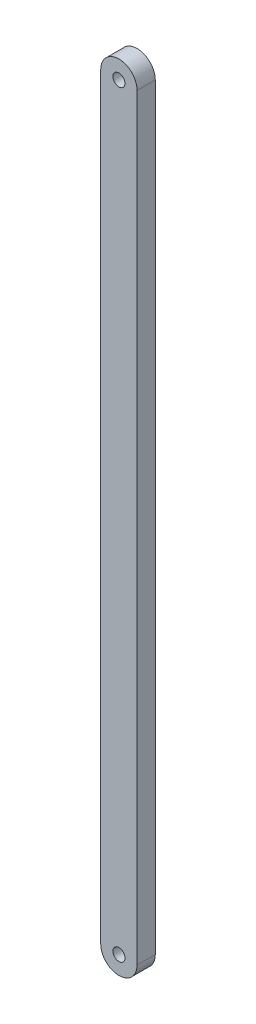
from build123d import *

# Parameters (mm, degrees)
BOSS_EXTRUDE1_DEPTH = 3
SKETCH2_R           = 1
CUT_EXTRUDE1_DEPTH  = 3


with BuildPart() as part:
    # Sketch1 → Boss-Extrude1 (new body)
    with BuildSketch(Plane.XY):
        with BuildLine():
            Line((-3, 125), (-3, 0))
            ThreePointArc((-3, 0), (0, -3), (3, 0))
            Line((3, 0), (3, 125))
            ThreePointArc((3, 125), (0, 128), (-3, 125))
        make_face()
    extrude(amount=BOSS_EXTRUDE1_DEPTH)

    # Sketch2 → Cut-Extrude1 (cut)
    with BuildSketch(Plane.XY.offset(3)):
        with Locations((0, 125)):
            Circle(SKETCH2_R)
        Circle(SKETCH2_R)
    extrude(amount=-CUT_EXTRUDE1_DEPTH, mode=Mode.SUBTRACT)


solid = part.part
